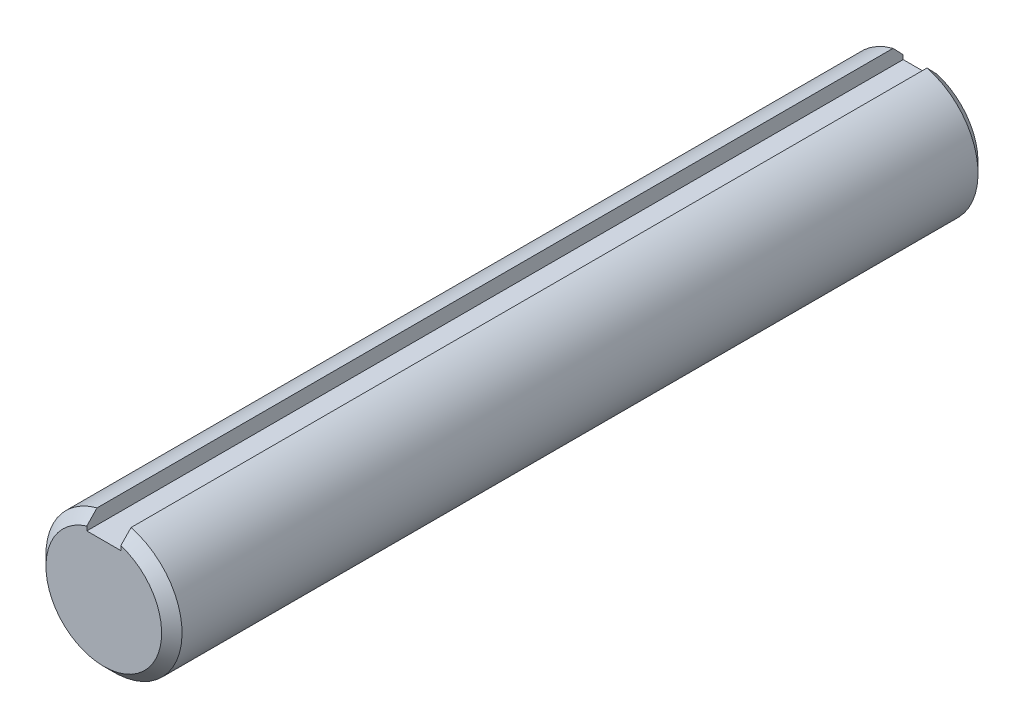
from build123d import *

# Parameters (mm, degrees)
SKETCH1_R           = 6.35
EXTRUDE1_DEPTH      = 38.1
CHAMFER1_SIZE       = 0.9525
EXTRUDE2_DEPTH      = 40.144028919
EXTRUDE2_DEPTH_BACK = 40.144028919
SKETCH3_W           = 3.175
SKETCH3_H           = 1.5875


with BuildPart() as part:
    # Sketch1 → Extrude1 (new, symmetric)
    with BuildSketch(Plane.XY):
        with Locations(Location((0, 0, 0), (0, 0, 180))):
            Circle(SKETCH1_R)
    extrude(amount=EXTRUDE1_DEPTH, both=True)

    # Chamfer1
    chamfer1_edges = [part.edges().sort_by_distance(p)[0] for p in [
        (6.35, 0, -38.1),
        (6.35, 0, 38.1),
    ]]
    chamfer(chamfer1_edges, length=CHAMFER1_SIZE)

    # Sketch3 → Extrude2 (cut, two sides: drawn at the far end of the back side and taken through both)
    with BuildSketch(Plane.XY.offset(-EXTRUDE2_DEPTH_BACK)):
        with Locations((0, 5.55625)):
            Rectangle(SKETCH3_W, SKETCH3_H)
    extrude(amount=EXTRUDE2_DEPTH + EXTRUDE2_DEPTH_BACK, mode=Mode.SUBTRACT)


solid = part.part
